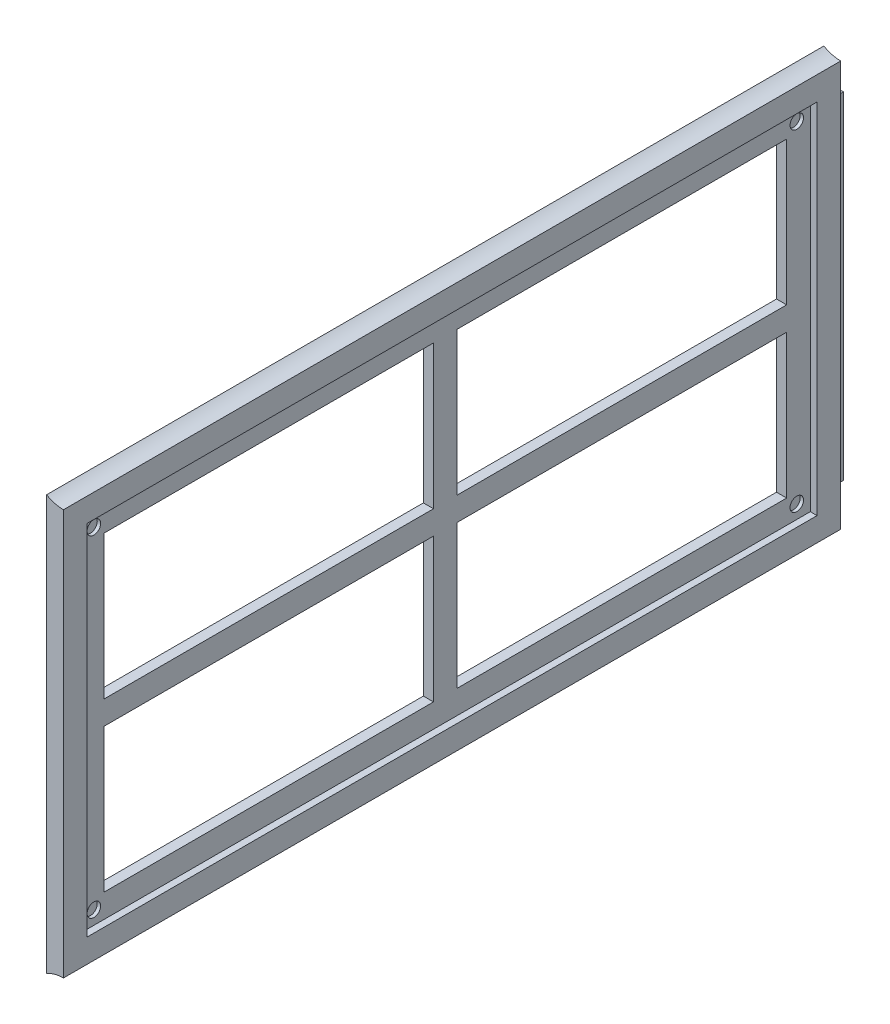
from build123d import *

# Parameters (mm, degrees)
ESBO_O1_W                = 1.6
ESBO_O1_H                = 99.6
RESSALTO_EXTRUS_O1_DEPTH = 230
ESBO_O2_W                = 1.6
ESBO_O2_H                = 99.6
RESSALTO_EXTRUS_O2_DEPTH = 232.5
ESBO_O5_W                = 97.5
ESBO_O5_H                = 42.5020002
CORTE_EXTRUS_O1_DEPTH    = 230
ESBO_O3_W                = 216
ESBO_O3_H                = 106.0040004
CORTE_EXTRUS_O2_DEPTH    = 2
ESBO_O8_R                = 2
CORTE_EXTRUS_O3_DEPTH    = 1


with BuildPart() as part:
    # Esboço1 → Ressalto-extrusão1 (new body)
    with BuildSketch(Plane.XY):
        with BuildLine():
            Line((-2.7, -61.339745962), (-2.7, 61.339745962))
            ThreePointArc((-2.7, 61.339745962), (-0.288049674, 60.341775891), (2.3, 60.0020002))
            Line((2.3, 60.0020002), (2.3, -60.0020002))
            ThreePointArc((2.3, -60.0020002), (-0.288049674, -60.341775891), (-2.7, -61.339745962))
        make_face()
        with Locations((-0.2, 0.2)):
            Rectangle(ESBO_O1_W, ESBO_O1_H, mode=Mode.SUBTRACT)
    extrude(amount=RESSALTO_EXTRUS_O1_DEPTH)

    # Esboço2 → Ressalto-extrusão2 (add)
    with BuildSketch(Plane.XY.offset(230)):
        with Locations((-0.2, 0.2)):
            Rectangle(ESBO_O2_W, ESBO_O2_H)
    extrude(amount=-RESSALTO_EXTRUS_O2_DEPTH)

    # Esboço5 → Corte-extrusão1 (cut)
    with BuildSketch(Plane(origin=(2.3, 0, 0), x_dir=(0, 0, -1), z_dir=(1, 0, 0))):
        with Locations((-167.25, 24.7510001)):
            Rectangle(ESBO_O5_W, ESBO_O5_H)
        with Locations((-62.75, 24.7510001)):
            Rectangle(ESBO_O5_W, ESBO_O5_H)
        with Locations((-167.25, -24.7510001)):
            Rectangle(ESBO_O5_W, ESBO_O5_H)
        with Locations((-62.75, -24.7510001)):
            Rectangle(ESBO_O5_W, ESBO_O5_H)
    extrude(amount=-CORTE_EXTRUS_O1_DEPTH, mode=Mode.SUBTRACT)

    # Esboço3 → Corte-extrusão2 (cut)
    with BuildSketch(Plane(origin=(2.3, 0, 0), x_dir=(0, 0, -1), z_dir=(1, 0, 0))):
        with Locations((-115, 0)):
            Rectangle(ESBO_O3_W, ESBO_O3_H)
    extrude(amount=-CORTE_EXTRUS_O2_DEPTH, mode=Mode.SUBTRACT)

    # Esboço8 → Corte-extrusão3 (cut)
    with BuildSketch(Plane(origin=(0.3, 0, 0), x_dir=(0, 0, -1), z_dir=(1, 0, 0))):
        with Locations(Location((-219, 49, 0), (0, 0, 90))):
            Circle(ESBO_O8_R)
        with Locations(Location((-11, 49, 0), (0, 0, 90))):
            Circle(ESBO_O8_R)
        with Locations(Location((-11, -49, 0), (0, 0, 90))):
            Circle(ESBO_O8_R)
        with Locations(Location((-219, -49, 0), (0, 0, 90))):
            Circle(ESBO_O8_R)
    extrude(amount=-CORTE_EXTRUS_O3_DEPTH, mode=Mode.SUBTRACT)


solid = part.part
